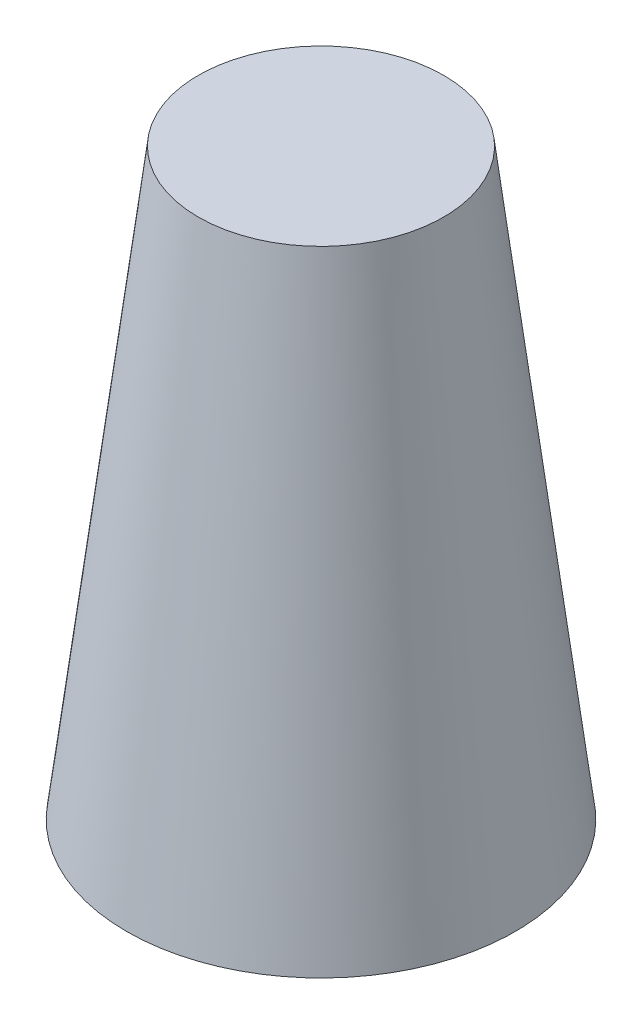
from build123d import *

# Parameters (mm, degrees)
SKETCH1_R           = 0.635
BOSS_EXTRUDE1_DEPTH = 1.905
BOSS_EXTRUDE1_TAPER = 7


with BuildPart() as part:
    # Sketch1 → Boss-Extrude1 (new body)
    with BuildSketch(Plane(origin=(0, 0, 0), x_dir=(1, 0, 0), z_dir=(0, 1, 0))):
        Circle(SKETCH1_R)
    extrude(amount=BOSS_EXTRUDE1_DEPTH, taper=BOSS_EXTRUDE1_TAPER)


solid = part.part
